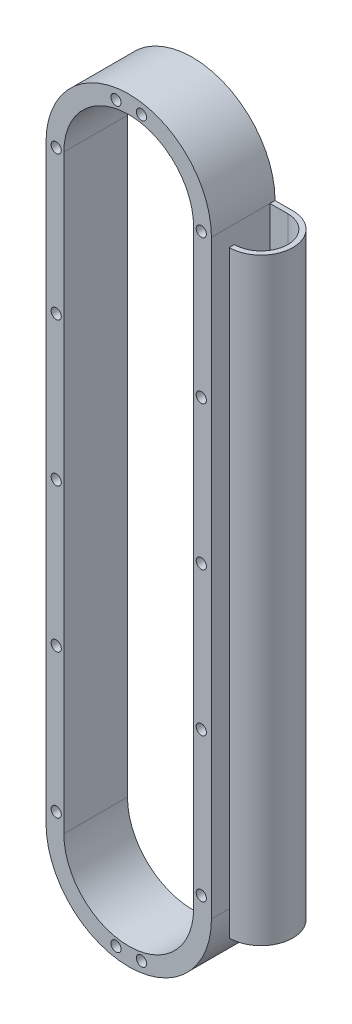
from build123d import *

# Parameters (mm, degrees)
BOSS_EXTRUDE1_DEPTH     = 25
SKETCH2_R               = 2
CUT_EXTRUDE1_DEPTH      = 155.056807704
SKETCH4_R               = 2
CUT_EXTRUDE2_DEPTH      = 155.056807704
LPATTERN1_COUNT         = 5
LPATTERN1_PITCH         = 56.5
MIRROR2_COPY_1_SKETCH_R = 2
MIRROR2_COPY_1_DEPTH    = 155.056807704
MIRROR2_COPY_2_SKETCH_R = 2
MIRROR2_COPY_2_DEPTH    = 155.056807704
MIRROR2_COPY_3_SKETCH_R = 2
MIRROR2_COPY_3_DEPTH    = 155.056807704
MIRROR2_COPY_4_SKETCH_R = 2
MIRROR2_COPY_4_DEPTH    = 155.056807704
BOSS_EXTRUDE2_DEPTH     = 235


with BuildPart() as part:
    # Sketch1 → Boss-Extrude1 (new body)
    with BuildSketch(Plane.XY):
        with BuildLine():
            Line((-32.5, -116), (-32.5, 116))
            ThreePointArc((-32.5, 116), (0, 148.5), (32.5, 116))
            Line((32.5, 116), (32.5, -116))
            ThreePointArc((32.5, -116), (0, -148.5), (-32.5, -116))
        make_face()
        with BuildLine():
            Line((-25.5, -116), (-25.5, 116))
            ThreePointArc((-25.5, 116), (0, 141.5), (25.5, 116))
            Line((25.5, 116), (25.5, -116))
            ThreePointArc((25.5, -116), (0, -141.5), (-25.5, -116))
        make_face(mode=Mode.SUBTRACT)
    extrude(amount=BOSS_EXTRUDE1_DEPTH)

    # Sketch2 → Cut-Extrude1 (cut, through all)
    with BuildSketch(Plane.XY.offset(25)):
        with Locations((-5, 144)):
            Circle(SKETCH2_R)
        with Locations((5, 144)):
            Circle(SKETCH2_R)
    cut_extrude1 = extrude(amount=-CUT_EXTRUDE1_DEPTH, mode=Mode.SUBTRACT)

    # Mirror1: Cut-Extrude1 across plane
    add(cut_extrude1.mirror(Plane.ZX), mode=Mode.SUBTRACT)

    # Sketch4 → Cut-Extrude2 (cut, through all)
    with BuildSketch(Plane.XY.offset(25)):
        with Locations((28.5, 116)):
            Circle(SKETCH4_R)
    cut_extrude2 = extrude(amount=-CUT_EXTRUDE2_DEPTH, mode=Mode.SUBTRACT)

    # LPattern1: Cut-Extrude2 ×5
    with Locations(*[(0, -i * LPATTERN1_PITCH, 0) for i in range(1, LPATTERN1_COUNT)]):
        add(cut_extrude2, mode=Mode.SUBTRACT)

    # Mirror2: Cut-Extrude2 across plane
    add(cut_extrude2.mirror(Plane(origin=(0, 0, 0), x_dir=(0, 0, 1), z_dir=(1, 0, 0))), mode=Mode.SUBTRACT)

    # Mirror2 copy 1 sketch → Mirror2 copy 1 (cut, through all)
    with BuildSketch(Plane(origin=(0, -56.5, 25), x_dir=(-1, 0, 0), z_dir=(0, 0, 1))):
        with Locations((28.5, -116)):
            Circle(MIRROR2_COPY_1_SKETCH_R)
    extrude(amount=-MIRROR2_COPY_1_DEPTH, mode=Mode.SUBTRACT)

    # Mirror2 copy 2 sketch → Mirror2 copy 2 (cut, through all)
    with BuildSketch(Plane(origin=(0, -113, 25), x_dir=(-1, 0, 0), z_dir=(0, 0, 1))):
        with Locations((28.5, -116)):
            Circle(MIRROR2_COPY_2_SKETCH_R)
    extrude(amount=-MIRROR2_COPY_2_DEPTH, mode=Mode.SUBTRACT)

    # Mirror2 copy 3 sketch → Mirror2 copy 3 (cut, through all)
    with BuildSketch(Plane(origin=(0, -169.5, 25), x_dir=(-1, 0, 0), z_dir=(0, 0, 1))):
        with Locations((28.5, -116)):
            Circle(MIRROR2_COPY_3_SKETCH_R)
    extrude(amount=-MIRROR2_COPY_3_DEPTH, mode=Mode.SUBTRACT)

    # Mirror2 copy 4 sketch → Mirror2 copy 4 (cut, through all)
    with BuildSketch(Plane(origin=(0, -226, 25), x_dir=(-1, 0, 0), z_dir=(0, 0, 1))):
        with Locations((28.5, -116)):
            Circle(MIRROR2_COPY_4_SKETCH_R)
    extrude(amount=-MIRROR2_COPY_4_DEPTH, mode=Mode.SUBTRACT)

    # Sketch5 → Boss-Extrude2 (add)
    with BuildSketch(Plane(origin=(32.5, 116, 0), x_dir=(1, 0, 0), z_dir=(0, 1, 0))):
        with BuildLine():
            Line((0, 0), (7, 0))
            ThreePointArc((7, 0), (19.5, -12.5), (7, -25))
            Line((7, -25), (7, -23))
            ThreePointArc((7, -23), (17.5, -12.5), (7, -2))
            Line((7, -2), (0, -2))
            Line((0, -2), (0, 0))
        make_face()
    extrude(amount=-BOSS_EXTRUDE2_DEPTH)


solid = part.part
